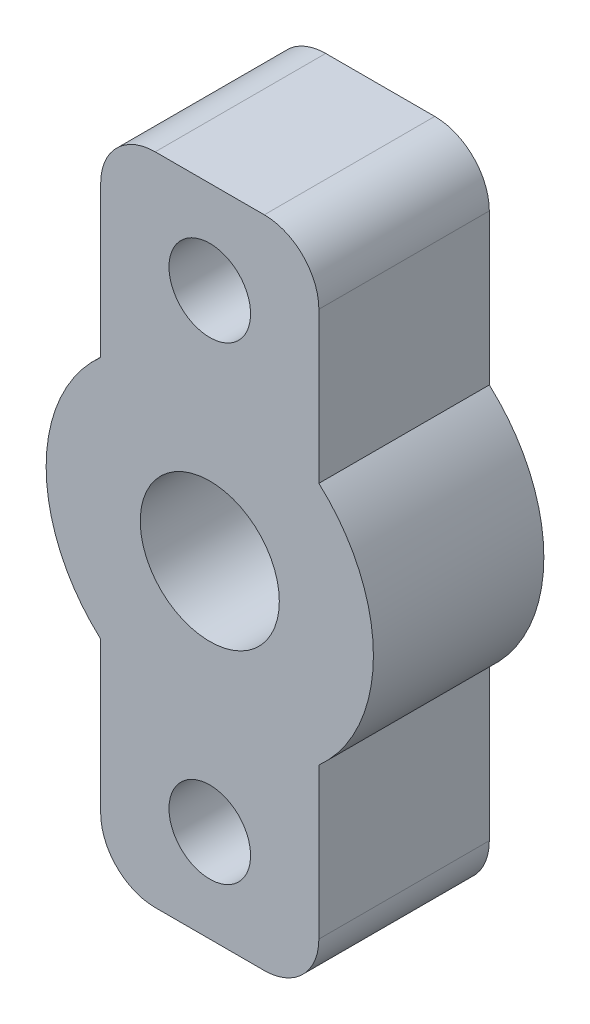
from build123d import *

# Parameters (mm, degrees)
EXTRUDE_1_DEPTH     = 7.9375
SKETCH_4_R          = 1.9
CUT_EXTRUDE_3_DEPTH = 19.796965347
SKETCH_5_R          = 3.2385
CUT_EXTRUDE_4_DEPTH = 19.796965347


with BuildPart() as part:
    # 草图1 → 凸台-拉伸1 (new body)
    with BuildSketch(Plane.XY):
        with BuildLine():
            Line((-5.08, 12.7), (-5.08, 5.679612663))
            ThreePointArc((-5.08, 5.679612663), (-7.62, 0), (-5.08, -5.679612663))
            Line((-5.08, -5.679612663), (-5.08, -12.7))
            ThreePointArc((-5.08, -12.7), (-4.336051224, -14.496051224), (-2.54, -15.24))
            Line((-2.54, -15.24), (2.54, -15.24))
            ThreePointArc((2.54, -15.24), (4.336051224, -14.496051224), (5.08, -12.7))
            Line((5.08, -12.7), (5.08, -5.679612663))
            ThreePointArc((5.08, -5.679612663), (7.62, 0), (5.08, 5.679612663))
            Line((5.08, 5.679612663), (5.08, 12.7))
            ThreePointArc((5.08, 12.7), (4.336051224, 14.496051224), (2.54, 15.24))
            Line((2.54, 15.24), (-2.54, 15.24))
            ThreePointArc((-2.54, 15.24), (-4.336051224, 14.496051224), (-5.08, 12.7))
        make_face()
    extrude(amount=EXTRUDE_1_DEPTH)

    # 草图4 → 切除-拉伸3 (cut, through all)
    with BuildSketch(Plane(origin=(0, 0, 0), x_dir=(-1, 0, 0), z_dir=(0, 0, -1))):
        with Locations((0, 10.922)):
            Circle(SKETCH_4_R)
    cut_extrude_3 = extrude(amount=-CUT_EXTRUDE_3_DEPTH, mode=Mode.SUBTRACT)

    # 镜向1: 切除-拉伸3 across plane
    add(cut_extrude_3.mirror(Plane.ZX), mode=Mode.SUBTRACT)

    # 草图5 → 切除-拉伸4 (cut, through all)
    with BuildSketch(Plane.XY.offset(7.9375)):
        Circle(SKETCH_5_R)
    extrude(amount=-CUT_EXTRUDE_4_DEPTH, mode=Mode.SUBTRACT)


solid = part.part
